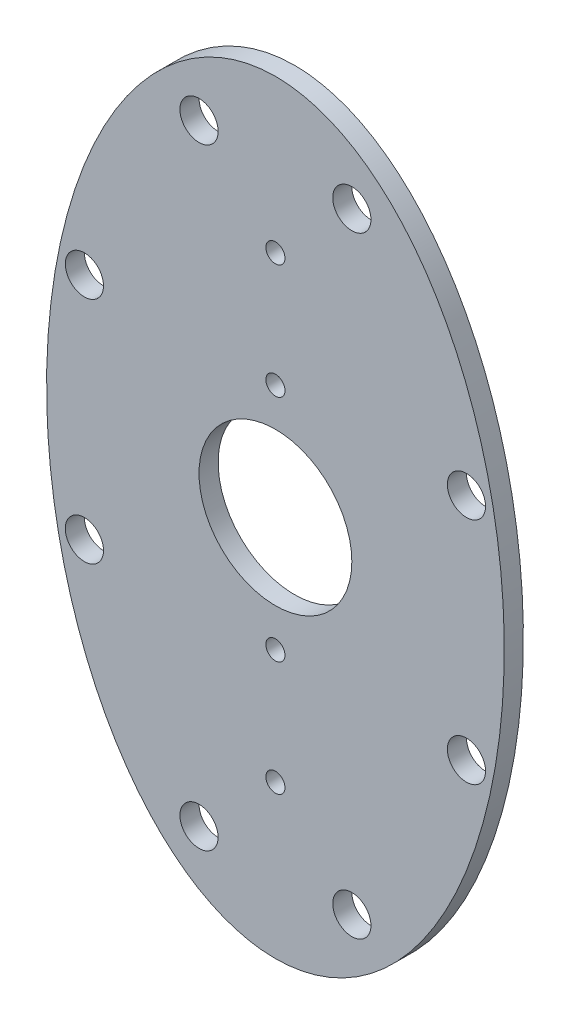
from build123d import *

# Parameters (mm, degrees)
SKETCH2_RX          = 254
SKETCH2_RY          = 152.143434343
BOSS_EXTRUDE2_DEPTH = 12.7
SKETCH3_R           = 50.8
SKETCH3_R_2         = 12.7
SKETCH3_R_3         = 6.35
CUT_EXTRUDE1_DEPTH  = 12.7


with BuildPart() as part:
    # Sketch2 → Boss-Extrude2 (new body)
    with BuildSketch(Plane(origin=(0, 0, 0), x_dir=(0, 1, 0), z_dir=(0, 0, 1))):
        with Locations((0, 0)):
            Ellipse(SKETCH2_RX, SKETCH2_RY)
    extrude(amount=BOSS_EXTRUDE2_DEPTH)

    # Sketch3 → Cut-Extrude1 (cut)
    with BuildSketch(Plane.XY.offset(12.7)):
        Circle(SKETCH3_R)
        with Locations((-50.8, 203.2)):
            Circle(SKETCH3_R_2)
        with Locations((50.8, 203.2)):
            Circle(SKETCH3_R_2)
        with Locations((127, 76.2)):
            Circle(SKETCH3_R_2)
        with Locations((127, -76.2)):
            Circle(SKETCH3_R_2)
        with Locations((-50.8, -203.2)):
            Circle(SKETCH3_R_2)
        with Locations((50.8, -203.2)):
            Circle(SKETCH3_R_2)
        with Locations((-127, 76.2)):
            Circle(SKETCH3_R_2)
        with Locations((-127, -76.2)):
            Circle(SKETCH3_R_2)
        with Locations((0, 76.2)):
            Circle(SKETCH3_R_3)
        with Locations((0, -76.2)):
            Circle(SKETCH3_R_3)
        with Locations((0, 152.4)):
            Circle(SKETCH3_R_3)
        with Locations((0, -152.4)):
            Circle(SKETCH3_R_3)
    extrude(amount=-CUT_EXTRUDE1_DEPTH, mode=Mode.SUBTRACT)


solid = part.part
